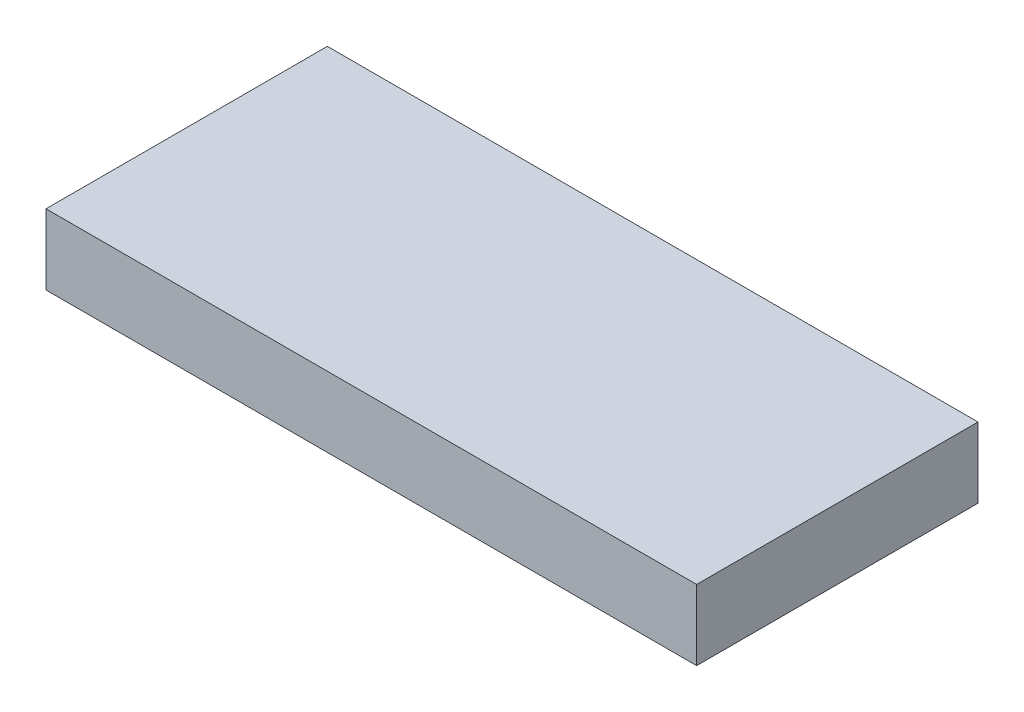
from build123d import *

# Parameters (mm, degrees)
SKETCH1_W           = 304.8
SKETCH1_H           = 304.8
BOSS_EXTRUDE1_DEPTH = 6.35
CUT_EXTRUDE2_DEPTH  = 6.35


with BuildPart() as part:
    # Sketch1 → Boss-Extrude1 (new body)
    with BuildSketch(Plane(origin=(0, 0, 0), x_dir=(1, 0, 0), z_dir=(0, 1, 0))):
        with Locations((152.4, 152.4)):
            Rectangle(SKETCH1_W, SKETCH1_H)
    extrude(amount=BOSS_EXTRUDE1_DEPTH)

    # Sketch2 → Cut-Extrude2 (cut)
    with BuildSketch(Plane(origin=(0, 6.35, 0), x_dir=(1, 0, 0), z_dir=(0, 1, 0))):
        Polygon((58.7375, 304.8), (58.7375, 279.4), (0, 279.4), (0, 0), (304.8, 0), (304.8, 304.8), align=None)
    extrude(amount=-CUT_EXTRUDE2_DEPTH, mode=Mode.SUBTRACT)


solid = part.part
